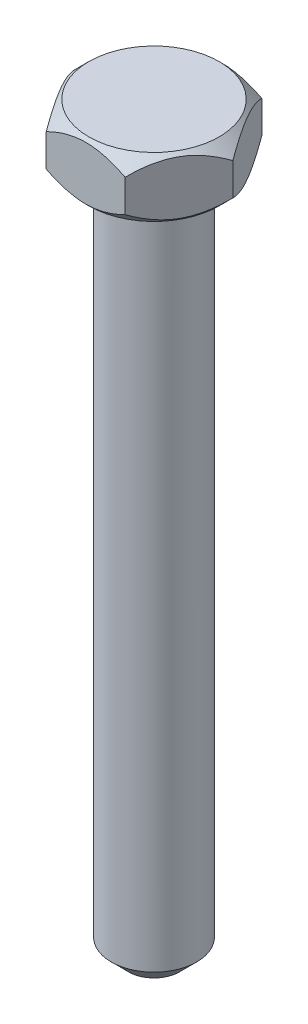
from build123d import *

# Parameters (mm, degrees)
EXTRUDE_1_DEPTH = 3.5
SKETCH_5_R      = 2.5
EXTRUDE_2_DEPTH = 40
CHAMFER_1_SIZE  = 1


with BuildPart() as part:
    # Эскиз1 → Вытянуть1 (new body)
    with BuildSketch(Plane(origin=(0, 0, 0), x_dir=(1, 0, 0), z_dir=(0, 1, 0))):
        Polygon((-2.309401077, 4), (2.309401077, 4), (4.618802154, 0), (2.309401077, -4), (-2.309401077, -4), (-4.618802154, 0), align=None)
    extrude(amount=-EXTRUDE_1_DEPTH)

    # Эскиз5 → Вытянуть2 (add)
    with BuildSketch(Plane.XZ.offset(3.5)):
        with Locations(Location((0, 0, 0), (0, 0, 90))):
            Circle(SKETCH_5_R)
    extrude(amount=EXTRUDE_2_DEPTH)

    # Фаска1
    chamfer_1_edges = [part.edges().sort_by_distance(p)[0] for p in [
        (0, -43.5, -2.5),
    ]]
    chamfer(chamfer_1_edges, length=CHAMFER_1_SIZE)

    # Эскиз4 → Вырез-Повернуть1 (revolve, cut)
    with BuildSketch(Plane.XY, mode=Mode.PRIVATE) as cut_revolve_1_sk:
        Polygon((-4.618802154, -0.8), (-3.818802154, 0), (-4.618802154, 0), align=None)
        Polygon((-4.618802154, -2.7), (-3.818802154, -3.5), (-4.618802154, -3.5), align=None)
    revolve(cut_revolve_1_sk.sketch.rotate(Axis((0, -3.5, 0), (0, -1, 0)), 120.000000119), axis=Axis((0, -3.5, 0), (0, -1, 0)), mode=Mode.SUBTRACT)


solid = part.part
